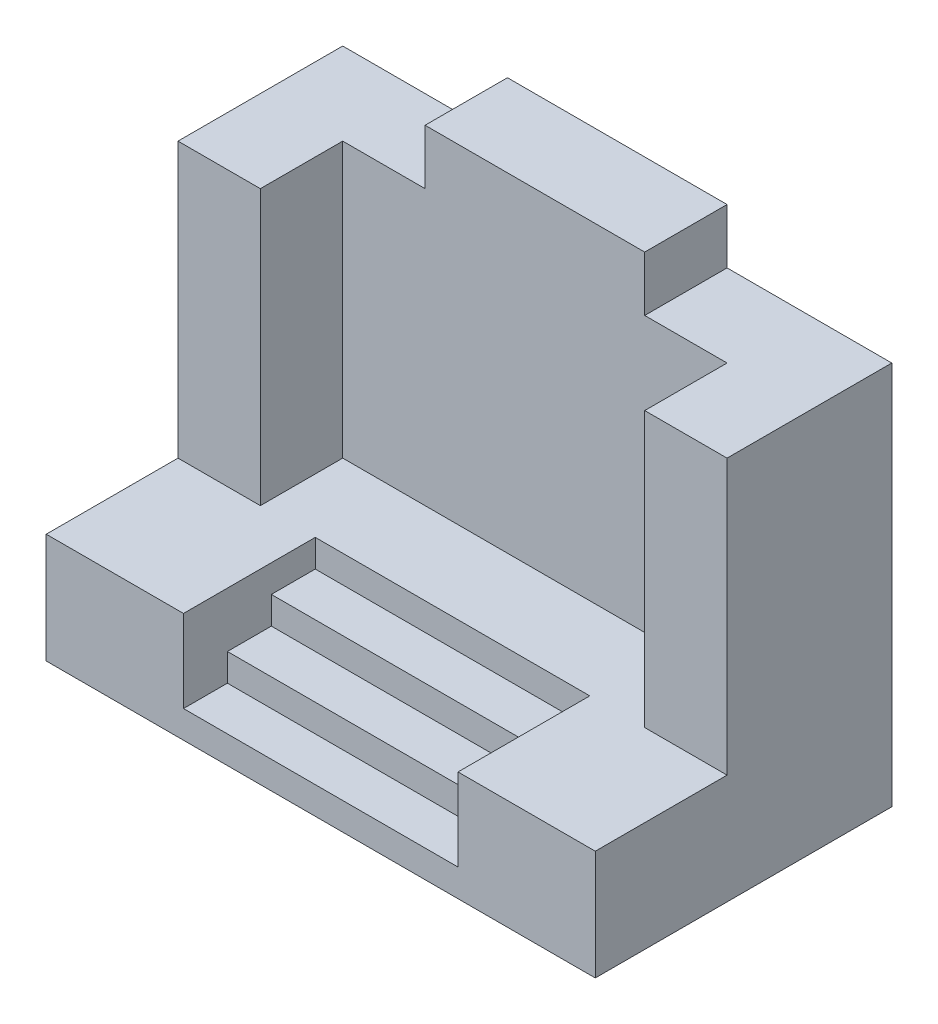
from build123d import *

# Parameters (mm, degrees)
BOSS_EXTRUDE1_DEPTH   = 700
BOSS_EXTRUDE1_2_DEPTH = 700
BOSS_EXTRUDE2_DEPTH   = 200
SKETCH1_4_W           = 400
SKETCH1_4_H           = 150
BOSS_EXTRUDE3_DEPTH   = 800
SKETCH1_5_W           = 500
SKETCH1_5_H           = 80
BOSS_EXTRUDE4_DEPTH   = 150
SKETCH1_6_W           = 500
SKETCH1_6_H           = 80
BOSS_EXTRUDE5_DEPTH   = 100
SKETCH1_7_W           = 500
SKETCH1_7_H           = 80
BOSS_EXTRUDE6_DEPTH   = 50


with BuildPart() as part:
    # Sketch1 → Boss-Extrude1 (new body)
    with BuildSketch(Plane(origin=(0, 0, 0), x_dir=(1, 0, 0), z_dir=(0, 1, 0))):
        Polygon((-500, 540), (-500, 240), (-350, 240), (-350, 390), (-200, 390), (-200, 540), align=None)
    extrude(amount=BOSS_EXTRUDE1_DEPTH)



with BuildPart() as body_2:
    # Sketch1 → Boss-Extrude1 2 (new body)
    with BuildSketch(Plane(origin=(0, 0, 0), x_dir=(1, 0, 0), z_dir=(0, 1, 0))):
        Polygon((350, 240), (500, 240), (500, 540), (200, 540), (200, 390), (350, 390), align=None)
    extrude(amount=BOSS_EXTRUDE1_2_DEPTH)


with BuildPart() as part_1:
    add(part.part)

    add(body_2.part)  # Boss-Extrude2 merges body 2
    # Sketch1<3> → Boss-Extrude2 (add)
    with BuildSketch(Plane(origin=(0, 0, 0), x_dir=(1, 0, 0), z_dir=(0, 1, 0))):
        Polygon((-500, 240), (-500, 0), (-250, 0), (-250, 80), (-250, 160), (-250, 240), (250, 240), (250, 160), (250, 80), (250, 0), (500, 0), (500, 240), (350, 240), (350, 390), (200, 390), (-200, 390), (-350, 390), (-350, 240), align=None)
    extrude(amount=BOSS_EXTRUDE2_DEPTH)

    # Sketch1<4> → Boss-Extrude3 (add)
    with BuildSketch(Plane(origin=(0, 0, 0), x_dir=(1, 0, 0), z_dir=(0, 1, 0))):
        with Locations((0, 465)):
            Rectangle(SKETCH1_4_W, SKETCH1_4_H)
    extrude(amount=BOSS_EXTRUDE3_DEPTH)

    # Sketch1<5> → Boss-Extrude4 (add)
    with BuildSketch(Plane(origin=(0, 0, 0), x_dir=(1, 0, 0), z_dir=(0, 1, 0))):
        with Locations((0, 200)):
            Rectangle(SKETCH1_5_W, SKETCH1_5_H)
    extrude(amount=BOSS_EXTRUDE4_DEPTH)

    # Sketch1<6> → Boss-Extrude5 (add)
    with BuildSketch(Plane(origin=(0, 0, 0), x_dir=(1, 0, 0), z_dir=(0, 1, 0))):
        with Locations((0, 120)):
            Rectangle(SKETCH1_6_W, SKETCH1_6_H)
    extrude(amount=BOSS_EXTRUDE5_DEPTH)

    # Sketch1<7> → Boss-Extrude6 (add)
    with BuildSketch(Plane(origin=(0, 0, 0), x_dir=(1, 0, 0), z_dir=(0, 1, 0))):
        with Locations((0, 40)):
            Rectangle(SKETCH1_7_W, SKETCH1_7_H)
    extrude(amount=BOSS_EXTRUDE6_DEPTH)


solid = part_1.part
